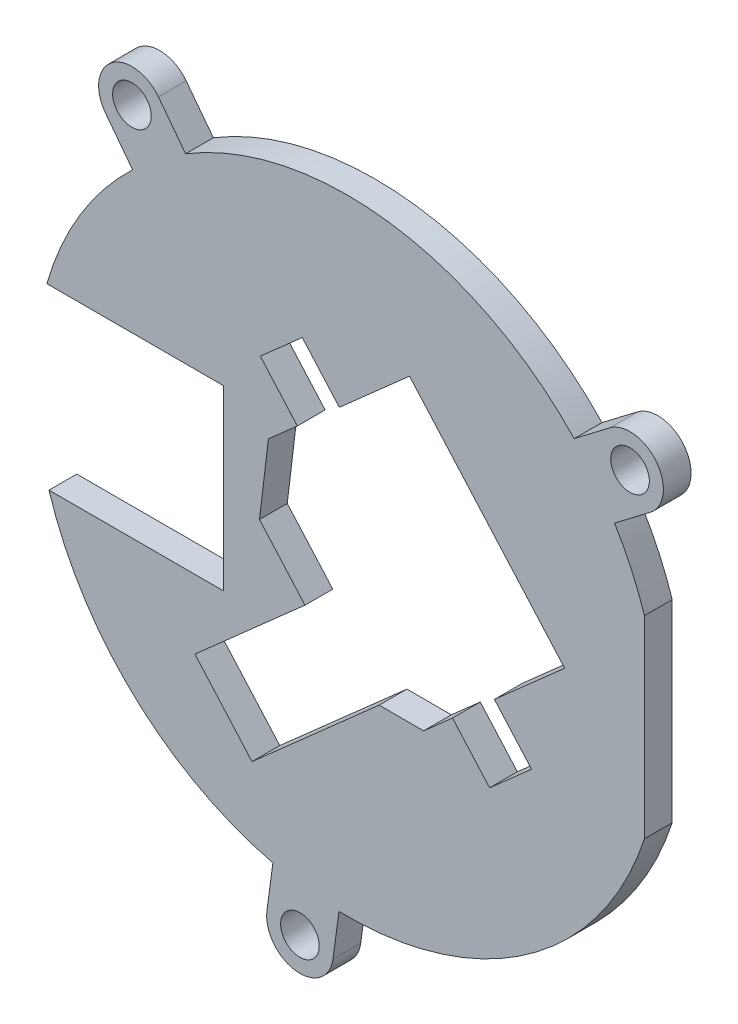
from build123d import *
from build123d.topology import SkipClean

# Parameters (mm, degrees)
SKETCH1_R           = 1.4224
BOSS_EXTRUDE1_DEPTH = 1.5875
CUT_EXTRUDE3_DEPTH  = 31.574112518
CUT_EXTRUDE4_DEPTH  = 31.574112518
SKETCH4_R           = 1.1049
BOSS_EXTRUDE2_DEPTH = 1.5875
SKETCH4_3_R         = 1.1049
CUT_EXTRUDE5_DEPTH  = 2.54


with BuildPart() as part:
    # Sketch1 → Boss-Extrude1 (new body)
    with BuildSketch(Plane.XY):
        with BuildLine():
            Line((-5.027565338, -0.720652536), (-4.515281158, 3.5306))
            Line((-4.515281158, 3.5306), (-2.860140414, 4.994714494))
            Line((-2.860140414, 4.994714494), (-4.980602482, 7.391837931))
            Line((-4.980602482, 7.391837931), (-2.583479045, 9.5123))
            Line((-2.583479045, 9.5123), (-0.463016976, 7.115176563))
            Line((-0.463016976, 7.115176563), (11.876076152, 18.030166811))
            ThreePointArc((11.876076152, 18.030166811), (-16.886200405, -13.453041882), (20.228041911, 7.546815251))
            Line((20.228041911, 7.546815251), (8.405899773, -2.910887338))
            Line((8.405899773, -2.910887338), (10.526361842, -5.308010776))
            Line((10.526361842, -5.308010776), (8.129238404, -7.428472845))
            Line((8.129238404, -7.428472845), (6.008776335, -5.031349407))
            Line((6.008776335, -5.031349407), (4.353635591, -6.495463901))
            Line((4.353635591, -6.495463901), (1.815981702, -6.489359631))
            Line((1.815981702, -6.489359631), (-5.455454601, -12.9215711))
            Line((-5.455454601, -12.9215711), (-8.720293025, -9.230761998))
            Line((-8.720293025, -9.230761998), (-2.425370717, -3.662361234))
            Line((-2.425370717, -3.662361234), (-5.027565338, -0.720652536))
        make_face()
        with Locations((0, 18.415)):
            Circle(SKETCH1_R, mode=Mode.SUBTRACT)
        with Locations((0, -18.415)):
            Circle(SKETCH1_R, mode=Mode.SUBTRACT)
    extrude(amount=BOSS_EXTRUDE1_DEPTH)

    # Sketch2 → Cut-Extrude3 (cut, through all)
    with BuildSketch(Plane.XY.offset(1.5875)):
        with BuildLine():
            Line((-7.084965338, 4.8768), (-21.031997569, 4.8768))
            ThreePointArc((-21.031997569, 4.8768), (-21.588987692, -0.209070373), (-20.933606898, -5.2832))
            Line((-20.933606898, -5.2832), (-7.084965338, -5.2832))
            Line((-7.084965338, -5.2832), (-7.084965338, 4.8768))
        make_face()
    extrude(amount=-CUT_EXTRUDE3_DEPTH, mode=Mode.SUBTRACT)

    # Sketch3 → Cut-Extrude4 (cut, through all)
    with BuildSketch(Plane(origin=(0, 0, 0), x_dir=(-1, 0, 0), z_dir=(0, 0, -1))):
        with BuildLine():
            Line((-20.871224203, -5.5245), (-16.984058744, -5.5245))
            Line((-16.984058744, -5.5245), (-16.984058744, 4.677232838))
            Line((-16.984058744, 4.677232838), (-20.228041911, 7.546815251))
            ThreePointArc((-20.228041911, 7.546815251), (-21.563910577, 1.061065789), (-20.871224203, -5.5245))
        make_face()
    extrude(amount=-CUT_EXTRUDE4_DEPTH, mode=Mode.SUBTRACT)

    # Sketch4 → Boss-Extrude2 (add)
    # profile 1 of 5: a face of its own
    with BuildSketch(Plane(origin=(0, 0, 0), x_dir=(-1, 0, 0), z_dir=(0, 0, -1))):
        with BuildLine():
            Line((-16.984058744, 5.5245), (-16.984058744, 4.677232838))
            Line((-16.984058744, 4.677232838), (-12.420130291, 0.640045174))
            Line((-12.420130291, 0.640045174), (-3.551213542, 10.666109075))
            Line((-3.551213542, 10.666109075), (-8.959431605, 15.450143591))
            ThreePointArc((-8.959431605, 15.450143591), (-11.076965007, 14.009967805), (-12.966760902, 12.28175327))
            Line((-12.966760902, 12.28175327), (-15.004080987, 13.83506338))
            ThreePointArc((-15.004080987, 13.83506338), (-17.674010029, 13.475162132), (-17.314108781, 10.80523309))
            Line((-17.314108781, 10.80523309), (-15.276788696, 9.25192298))
            ThreePointArc((-15.276788696, 9.25192298), (-16.237733521, 7.437362555), (-16.984058744, 5.5245))
        make_face()
        with Locations((-16.159094884, 12.320148235)):
            Circle(SKETCH4_R, mode=Mode.SUBTRACT)
    # profile 2 of 5: a face of its own
    with BuildSketch(Plane(origin=(0, 0, 0), x_dir=(-1, 0, 0), z_dir=(0, 0, -1))):
        with BuildLine():
            ThreePointArc((-1.288911844, -17.813395463), (-0.402766027, -17.855423019), (0.484373541, -17.853395586))
            Line((0.484373541, -17.853395586), (0.725034865, -19.638742704))
            ThreePointArc((0.725034865, -19.638742704), (0.955229003, -17.361074333), (-1.288911844, -17.813395463))
        make_face()
    # profile 3 of 5: a face of its own
    with BuildSketch(Plane(origin=(0, 0, 0), x_dir=(-1, 0, 0), z_dir=(0, 0, -1))):
        with BuildLine():
            ThreePointArc((4.327227494, -21.151907768), (2.884204284, -21.396482553), (1.427926458, -21.542727915))
            ThreePointArc((1.427926458, -21.542727915), (2.969033821, -22.025790864), (4.327227494, -21.151907768))
        make_face()
    # profile 4 of 5: a face of its own
    with BuildSketch(Plane(origin=(0, 0, 0), x_dir=(-1, 0, 0), z_dir=(0, 0, -1))):
        with BuildLine():
            ThreePointArc((1.288911844, 17.813395463), (0, 17.859965052), (-1.288911844, 17.813395463))
            ThreePointArc((-1.288911844, 17.813395463), (0, 16.9926), (1.288911844, 17.813395463))
        make_face()
    # profile 5 of 5: a face of its own
    with BuildSketch(Plane(origin=(0, 0, 0), x_dir=(-1, 0, 0), z_dir=(0, 0, -1))):
        with BuildLine():
            ThreePointArc((14.223312513, 16.242705475), (13.475162132, 17.674010029), (11.896845513, 18.016469323))
            ThreePointArc((11.896845513, 18.016469323), (13.0901575, 17.169038314), (14.223312513, 16.242705475))
        make_face()
    extrude(amount=-BOSS_EXTRUDE2_DEPTH)

    # Sketch4<3> → Cut-Extrude5 (cut)
    with SkipClean():  # the faces are left unmerged after this step: merging them gives an invalid solid
        with BuildSketch(Plane(origin=(0, 0, 0), x_dir=(-1, 0, 0), z_dir=(0, 0, -1))):
            with BuildLine():
                ThreePointArc((-20.871224203, -5.5245), (-12.595886757, -17.534872021), (1.427926458, -21.542727915))
                ThreePointArc((1.427926458, -21.542727915), (1.026270462, -21.020335978), (0.826620277, -20.392354546))
                Line((0.826620277, -20.392354546), (0.725034865, -19.638742704))
                ThreePointArc((0.725034865, -19.638742704), (-0.955229003, -19.468925667), (-1.288911844, -17.813395463))
                ThreePointArc((-1.288911844, -17.813395463), (-11.010431484, -14.062316673), (-16.984058744, -5.5245))
                Line((-16.984058744, -5.5245), (-20.871224203, -5.5245))
            make_face()
            with BuildLine():
                ThreePointArc((4.602470139, -19.883377319), (4.576225926, -20.541808877), (4.327227494, -21.151907768))
                ThreePointArc((4.327227494, -21.151907768), (14.915810742, -15.609186074), (20.933606898, -5.2832))
                Line((20.933606898, -5.2832), (17.060660873, -5.2832))
                ThreePointArc((17.060660873, -5.2832), (12.247990597, -12.998656777), (4.260223404, -17.344418359))
                Line((4.260223404, -17.344418359), (4.602470139, -19.883377319))
            make_face()
            with BuildLine():
                Line((-11.876076152, 18.030166811), (-8.959431605, 15.450143591))
                ThreePointArc((-8.959431605, 15.450143591), (-5.258647708, 17.068244665), (-1.288911844, 17.813395463))
                ThreePointArc((-1.288911844, 17.813395463), (0, 19.8374), (1.288911844, 17.813395463))
                ThreePointArc((1.288911844, 17.813395463), (5.420875683, 17.017416329), (9.25192298, 15.276788696))
                Line((9.25192298, 15.276788696), (10.80523309, 17.314108781))
                ThreePointArc((10.80523309, 17.314108781), (11.28937197, 17.76113274), (11.896845513, 18.016469323))
                ThreePointArc((11.896845513, 18.016469323), (0.01243973, 21.589996416), (-11.876076152, 18.030166811))
            make_face()
            with BuildLine():
                Line((13.83506338, 15.004080987), (12.28175327, 12.966760902))
                ThreePointArc((12.28175327, 12.966760902), (15.276744775, 9.251995502), (17.181244816, 4.8768))
                Line((17.181244816, 4.8768), (21.031997569, 4.8768))
                ThreePointArc((21.031997569, 4.8768), (18.521073783, 11.09495047), (14.223312513, 16.242705475))
                ThreePointArc((14.223312513, 16.242705475), (14.13793931, 15.589304916), (13.83506338, 15.004080987))
            make_face()
            with Locations((12.320148235, 16.159094884)):
                Circle(SKETCH4_3_R)
            with Locations((2.714545208, -20.137865932)):
                Circle(SKETCH4_3_R)
        extrude(amount=-CUT_EXTRUDE5_DEPTH, mode=Mode.SUBTRACT)


solid = part.part
